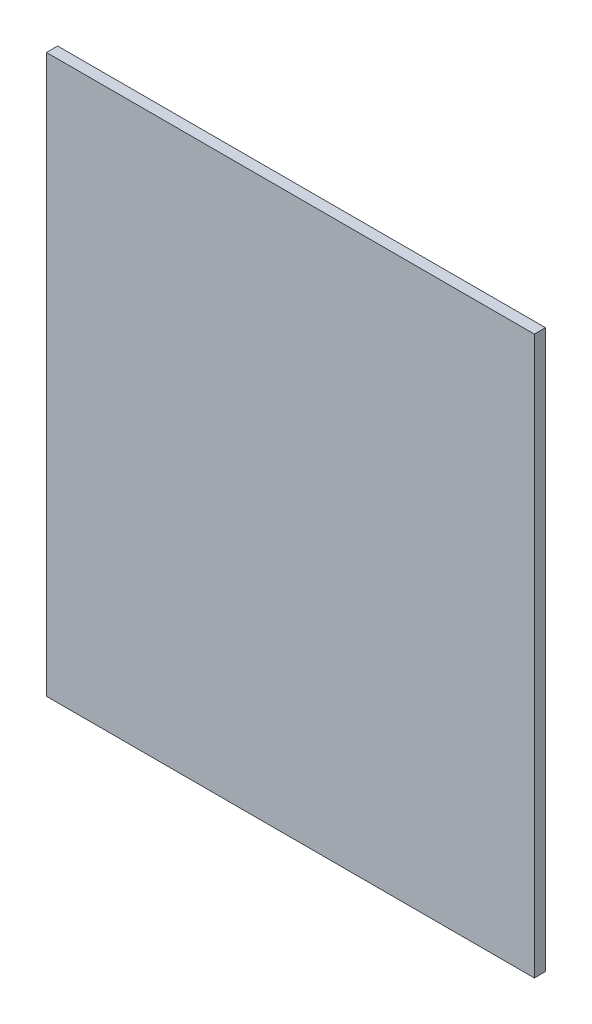
from build123d import *

# Parameters (mm, degrees)
SKETCH_1_W      = 700
SKETCH_1_H      = 800
EXTRUDE_1_DEPTH = 16


with BuildPart() as part:
    # Эскиз1 → Бобышка-Вытянуть1 (new body)
    with BuildSketch(Plane.XY):
        with Locations((312.337172391, -356.419257541)):
            Rectangle(SKETCH_1_W, SKETCH_1_H)
    extrude(amount=EXTRUDE_1_DEPTH)


solid = part.part
